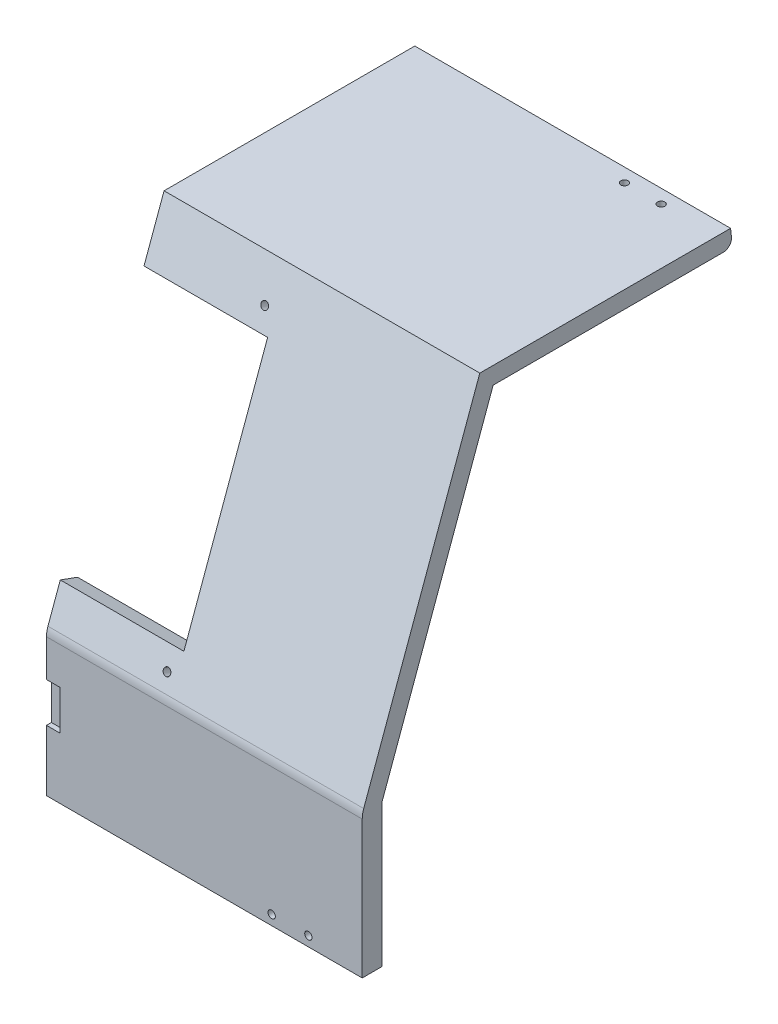
from build123d import *

# Parameters (mm, degrees)
SKETCH1_W                = 170
SKETCH1_H                = 130
BOSS_EXTRUDE1_DEPTH      = 8
SKETCH2_R                = 1.5
SKETCH2_W                = 165
SKETCH2_H                = 100
CUT_EXTRUDE1_DEPTH       = 21
SKETCH3_W                = 170
SKETCH3_H                = 20
BOSS_EXTRUDE2_DEPTH      = 8
SKETCH4_W                = 65
SKETCH4_H                = 16.2
CUT_EXTRUDE2_DEPTH       = 2
SKETCH5_W                = 3.5
SKETCH5_H                = 12
CUT_EXTRUDE3_DEPTH       = 35
SKETCH6_W                = 170
SKETCH6_H                = 150
BOSS_EXTRUDE3_DEPTH      = 8
BOSS_EXTRUDE4_DEPTH      = 138
SKETCH8_W                = 249
SKETCH8_H                = 138
BOSS_EXTRUDE5_DEPTH      = 1
SKETCH9_W                = 72.8
SKETCH9_H                = 73.25
CUT_EXTRUDE4_DEPTH       = 19
BOSS_EXTRUDE6_DEPTH      = 5
SKETCH11_R               = 1.5
CUT_EXTRUDE5_DEPTH       = 56
SKETCH12_R               = 9
SKETCH12_R_2             = 6.5
SKETCH12_R_3             = 1
SKETCH12_R_4             = 2.75
CUT_EXTRUDE6_DEPTH       = 115
SKETCH13_W               = 58.59049163
SKETCH13_H               = 30.075830986
CUT_EXTRUDE7_DEPTH       = 3
FILLET1_R                = 2
SKETCH15_R               = 1.5
CUT_EXTRUDE8_DEPTH       = 10
CUT_EXTRUDE10_DEPTH      = 261
SKETCH19_R               = 1.5
BOSS_EXTRUDE7_DEPTH      = 8
BOSS_EXTRUDE12_START     = -124.5
BOSS_EXTRUDE12_DEPTH     = 249
SKETCH22_R               = 1.5
SKETCH22_W               = 165
SKETCH22_H               = 100
CUT_EXTRUDE11_DEPTH      = 18
FILLET2_R                = 10
SKETCH24_R               = 2
SKETCH24_W               = 3
SKETCH24_H               = 72
CUT_EXTRUDE15_DEPTH      = 42
CUT_EXTRUDE16_DEPTH      = 140
CUT_EXTRUDE16_DEPTH_BACK = 242
SKETCH27_W               = 249
SKETCH27_H               = 105
BOSS_EXTRUDE13_DEPTH     = 7
CUT_EXTRUDE17_DEPTH      = 249
FILLET6_R                = 3
FILLET7_R                = 3
BOSS_EXTRUDE14_DEPTH     = 9
SKETCH30_R               = 1.5
CUT_EXTRUDE18_DEPTH      = 10
SKETCH31_R               = 1.5
CUT_EXTRUDE19_DEPTH      = 49
CUT_EXTRUDE20_DEPTH      = 49
SKETCH34_W               = 129
SKETCH34_H               = 190
CUT_EXTRUDE21_DEPTH      = 222


with BuildPart() as part:
    # Sketch1 → Boss-Extrude1 (new body)
    with BuildSketch(Plane.XY):
        with Locations((85, 65)):
            Rectangle(SKETCH1_W, SKETCH1_H)
    extrude(amount=BOSS_EXTRUDE1_DEPTH)

    # Sketch2 → Cut-Extrude1 (cut)
    with BuildSketch(Plane.XY.offset(8)):
        with Locations((6.55, 123.35)):
            Circle(SKETCH2_R)
        with Locations((163.45, 123.35)):
            Circle(SKETCH2_R)
        with Locations((6.55, 6.65)):
            Circle(SKETCH2_R)
        with Locations((163.45, 6.65)):
            Circle(SKETCH2_R)
        with Locations((85, 65)):
            Rectangle(SKETCH2_W, SKETCH2_H)
    extrude(amount=-CUT_EXTRUDE1_DEPTH, mode=Mode.SUBTRACT)

    # Sketch3 → Boss-Extrude2 (add)
    with BuildSketch(Plane.XY.offset(8)):
        with Locations((85, -10)):
            Rectangle(SKETCH3_W, SKETCH3_H)
    extrude(amount=-BOSS_EXTRUDE2_DEPTH)

    # Sketch4 → Cut-Extrude2 (cut)
    with BuildSketch(Plane.XY.offset(8)):
        with Locations((85, -10)):
            Rectangle(SKETCH4_W, SKETCH4_H)
    extrude(amount=-CUT_EXTRUDE2_DEPTH, mode=Mode.SUBTRACT)

    # Sketch5 → Cut-Extrude3 (cut)
    with BuildSketch(Plane.XY.offset(6)):
        with Locations((63.25, -10)):
            Rectangle(SKETCH5_W, SKETCH5_H)
        with Locations((71.75, -10)):
            Rectangle(SKETCH5_W, SKETCH5_H)
        with Locations((80.75, -10)):
            Rectangle(SKETCH5_W, SKETCH5_H)
        with Locations((89.25, -10)):
            Rectangle(SKETCH5_W, SKETCH5_H)
        with Locations((98.25, -10)):
            Rectangle(SKETCH5_W, SKETCH5_H)
        with Locations((106.75, -10)):
            Rectangle(SKETCH5_W, SKETCH5_H)
    extrude(amount=-CUT_EXTRUDE3_DEPTH, mode=Mode.SUBTRACT)

    # Sketch6 → Boss-Extrude3 (add)
    with BuildSketch(Plane.XY.offset(8)):
        Polygon((15.504384948, 140), (225, 140), (225, -35), (-10, -35), (-10, 140), align=None)
        with Locations((85, 55)):
            Rectangle(SKETCH6_W, SKETCH6_H, mode=Mode.SUBTRACT)
    extrude(amount=-BOSS_EXTRUDE3_DEPTH)

    # Sketch7 → Boss-Extrude4 (add)
    with BuildSketch(Plane.XY.offset(8)):
        Polygon((-10, 140), (-17, 140), (-17, -42), (232, -42), (232, 140), (225, 140), (225, -35), (-10, -35), align=None)
    extrude(amount=-BOSS_EXTRUDE4_DEPTH)

    # Sketch8 → Boss-Extrude5 (add)
    with BuildSketch(Plane.XZ.offset(42)):
        with Locations((107.5, -61)):
            Rectangle(SKETCH8_W, SKETCH8_H)
    extrude(amount=BOSS_EXTRUDE5_DEPTH)

    # Sketch9 → Cut-Extrude4 (cut)
    with BuildSketch(Plane(origin=(232, 0, 0), x_dir=(0, 0, -1), z_dir=(1, 0, 0))):
        with Locations((75, 35)):
            Rectangle(SKETCH9_W, SKETCH9_H)
    extrude(amount=-CUT_EXTRUDE4_DEPTH, mode=Mode.SUBTRACT)

    # Sketch10 → Boss-Extrude6 (add)
    with BuildSketch(Plane(origin=(232, 0, 0), x_dir=(0, 0, -1), z_dir=(1, 0, 0))):
        Polygon((36, 44), (36, -4), (114, -4), (114, 44), (119, 44), (119, -9), (31, -9), (31, 44), align=None)
    extrude(amount=BOSS_EXTRUDE6_DEPTH)

    # Sketch11 → Cut-Extrude5 (cut)
    with BuildSketch(Plane(origin=(237, 0, 0), x_dir=(0, 0, -1), z_dir=(1, 0, 0))):
        with Locations((33.5, 17.5)):
            Circle(SKETCH11_R)
        with Locations((116.5, 17.5)):
            Circle(SKETCH11_R)
    extrude(amount=-CUT_EXTRUDE5_DEPTH, mode=Mode.SUBTRACT)

    # Sketch12 → Cut-Extrude6 (cut)
    with BuildSketch(Plane(origin=(0, -35, 0), x_dir=(1, 0, 0), z_dir=(0, 1, 0))):
        with Locations(Location((166.25, 32.5, 0), (0, 0, 180))):
            Circle(SKETCH12_R)
        with Locations(Location((166.25, 97.5, 0), (0, 0, 180))):
            Circle(SKETCH12_R_2)
        with Locations(Location((155.75, 97.5, 0), (0, 0, 180))):
            Circle(SKETCH12_R_3)
        with Locations(Location((155.75, 85, 0), (0, 0, 180))):
            Circle(SKETCH12_R_3)
        with Locations(Location((176.75, 85, 0), (0, 0, 180))):
            Circle(SKETCH12_R_3)
        with Locations(Location((176.75, 97.5, 0), (0, 0, 180))):
            Circle(SKETCH12_R_3)
        with Locations(Location((145.25, 97.5, 0), (0, 0, 180))):
            Circle(SKETCH12_R_4)
        with Locations(Location((187.25, 97.5, 0), (0, 0, 180))):
            Circle(SKETCH12_R_4)
    extrude(amount=-CUT_EXTRUDE6_DEPTH, mode=Mode.SUBTRACT)

    # Sketch13 → Cut-Extrude7 (cut)
    with BuildSketch(Plane.XZ.offset(43)):
        with Locations((166.25, -93.48757215)):
            Rectangle(SKETCH13_W, SKETCH13_H)
    extrude(amount=-CUT_EXTRUDE7_DEPTH, mode=Mode.SUBTRACT)

    # Fillet1
    fillet1_edges = [part.edges().sort_by_distance(p)[0] for p in [
        (136.954754185, -40, -93.48757215),
        (166.25, -40, -78.449656657),
        (195.545245815, -40, -93.48757215),
        (166.25, -40, -108.525487643),
    ]]
    fillet(fillet1_edges, radius=FILLET1_R)

    # Sketch15 → Cut-Extrude8 (cut)
    with BuildSketch(Plane(origin=(0, 140, 0), x_dir=(1, 0, 0), z_dir=(0, 1, 0))):
        with Locations(Location((5, -4, 0), (0, 0, 270))):
            Circle(SKETCH15_R)
        with Locations(Location((20, -4, 0), (0, 0, 270))):
            Circle(SKETCH15_R)
        with Locations(Location((217, -4, 0), (0, 0, 90))):
            Circle(SKETCH15_R)
        with Locations(Location((202, -4, 0), (0, 0, 90))):
            Circle(SKETCH15_R)
    extrude(amount=-CUT_EXTRUDE8_DEPTH, mode=Mode.SUBTRACT)

    # Sketch18 → Cut-Extrude10 (cut)
    with BuildSketch(Plane(origin=(232, 0, 0), x_dir=(0, 0, -1), z_dir=(1, 0, 0))):
        Polygon((45.496279283, 140), (-8, 140), (-8, 15), (0, 15), align=None)
    extrude(amount=-CUT_EXTRUDE10_DEPTH, mode=Mode.SUBTRACT)

    # Sketch19 → Boss-Extrude7 (add)
    with BuildSketch(Plane.XY.offset(8)):
        with Locations((6.55, 6.65)):
            Circle(SKETCH19_R)
        with Locations((163.45, 6.65)):
            Circle(SKETCH19_R)
    extrude(amount=-BOSS_EXTRUDE7_DEPTH)

    # Sketch21 → Boss-Extrude12 (add)
    with BuildSketch(Plane(origin=(107.5, 0, 0), x_dir=(0, 0, -1), z_dir=(1, 0, 0)).offset(BOSS_EXTRUDE12_START)):
        Polygon((45.496279283, 140), (0, 15), (-8, 15), (37.496279283, 140), align=None)
    extrude(amount=BOSS_EXTRUDE12_DEPTH)

    # Sketch22 → Cut-Extrude11 (cut)
    with BuildSketch(Plane(origin=(0, 4.325817115, 11.885084845), x_dir=(1, 0, 0), z_dir=(0, 0.3420201433256603, 0.9396926207859115))):
        with Locations(Location((1.55, 136.220338945, 0), (0, 0, 270))):
            Circle(SKETCH22_R)
        with Locations(Location((158.45, 136.220338945, 0), (0, 0, 270))):
            Circle(SKETCH22_R)
        with Locations(Location((1.55, 19.520338945, 0), (0, 0, 270))):
            Circle(SKETCH22_R)
        with Locations(Location((158.45, 19.520338945, 0), (0, 0, 270))):
            Circle(SKETCH22_R)
        with Locations((80, 77.870338945)):
            Rectangle(SKETCH22_W, SKETCH22_H)
    extrude(amount=-CUT_EXTRUDE11_DEPTH, mode=Mode.SUBTRACT)

    # Fillet2
    fillet2_edges = [part.edges().sort_by_distance(p)[0] for p in [
        (107.5, 15, 8),
    ]]
    fillet(fillet2_edges, radius=FILLET2_R)

    # Sketch24 → Cut-Extrude15 (cut)
    with BuildSketch(Plane(origin=(-10, 0, 0), x_dir=(0, 0, -1), z_dir=(1, 0, 0))):
        with Locations(Location((113.5, 48.5, 0), (0, 0, 90))):
            Circle(SKETCH24_R)
        with Locations(Location((119.5, 68.5, 0), (0, 0, 90))):
            Circle(SKETCH24_R)
        with Locations(Location((119.5, 28.5, 0), (0, 0, 90))):
            Circle(SKETCH24_R)
        with Locations((128.5, 48.5)):
            Rectangle(SKETCH24_W, SKETCH24_H)
    extrude(amount=-CUT_EXTRUDE15_DEPTH, mode=Mode.SUBTRACT)

    # Sketch25 → Cut-Extrude16 (cut, two sides: drawn at the far end of the back side and taken through both)
    with BuildSketch(Plane(origin=(232, 0, 0), x_dir=(0, 0, -1), z_dir=(1, 0, 0)).offset(-CUT_EXTRUDE16_DEPTH_BACK)):
        Polygon((45.496279283, 140), (130, 140), (130, -43), (0, -43), (0, 15), align=None)
    extrude(amount=CUT_EXTRUDE16_DEPTH + CUT_EXTRUDE16_DEPTH_BACK, mode=Mode.SUBTRACT)

    # Sketch27 → Boss-Extrude13 (add)
    with BuildSketch(Plane(origin=(0, 140, 0), x_dir=(1, 0, 0), z_dir=(0, 1, 0))):
        with Locations((107.5, 89.996279283)):
            Rectangle(SKETCH27_W, SKETCH27_H)
    extrude(amount=BOSS_EXTRUDE13_DEPTH)

    # Sketch28 → Cut-Extrude17 (cut)
    with BuildSketch(Plane(origin=(232, 0, 0), x_dir=(0, 0, -1), z_dir=(1, 0, 0))):
        Polygon((37.496279283, 140), (40.044070923, 147), (37.496279283, 147), align=None)
    extrude(amount=-CUT_EXTRUDE17_DEPTH, mode=Mode.SUBTRACT)

    # Fillet6
    fillet6_edges = [part.edges().sort_by_distance(p)[0] for p in [
        (107.5, 140, -142.496279283),
    ]]
    fillet(fillet6_edges, radius=FILLET6_R)

    # Fillet7
    fillet7_edges = [part.edges().sort_by_distance(p)[0] for p in [
        (-17, 145, -142.496279283),
        (-17, 140, -134.748139642),
        (-17, 140.878679656, -141.617599627),
    ]]
    fillet(fillet7_edges, radius=FILLET7_R)

    # Sketch29 → Boss-Extrude14 (add)
    with BuildSketch(Plane(origin=(232, 0, 0), x_dir=(0, 0, -1), z_dir=(1, 0, 0))):
        with BuildLine():
            Line((-8, -43), (0, -43))
            Line((0, -43), (0, 15))
            Line((0, 15), (45.496279283, 140))
            Line((45.496279283, 140), (139.496279283, 140))
            ThreePointArc((139.496279283, 140), (141.886652657, 140.990125071), (142.876777727, 143.380498444))
            Line((142.876777727, 143.380498444), (142.496279283, 147))
            Line((142.496279283, 147), (40.044070923, 147))
            Line((40.044070923, 147), (-7.396926208, 16.656931626))
            ThreePointArc((-7.396926208, 16.656931626), (-7.84807753, 14.97321197), (-8, 13.236730193))
            Line((-8, 13.236730193), (-8, -43))
        make_face()
    extrude(amount=BOSS_EXTRUDE14_DEPTH)

    # Sketch30 → Cut-Extrude18 (cut)
    with BuildSketch(Plane(origin=(0, 147, 0), x_dir=(1, 0, 0), z_dir=(0, 1, 0))):
        with Locations(Location((218.25, 136.876777727, 0), (0, 0, 270))):
            Circle(SKETCH30_R)
        with Locations(Location((203.25, 136.876777727, 0), (0, 0, 270))):
            Circle(SKETCH30_R)
    extrude(amount=-CUT_EXTRUDE18_DEPTH, mode=Mode.SUBTRACT)

    # Sketch31 → Cut-Extrude19 (cut)
    with BuildSketch(Plane.XY.offset(8)):
        with Locations((219, -39)):
            Circle(SKETCH31_R)
        with Locations((204, -39)):
            Circle(SKETCH31_R)
    extrude(amount=-CUT_EXTRUDE19_DEPTH, mode=Mode.SUBTRACT)

    # Sketch32 → Cut-Extrude20 (cut)
    with BuildSketch(Plane.ZY.offset(17)):
        with BuildLine():
            Line((-110, 0.736730193), (-12, 0.736730193))
            ThreePointArc((-12, 0.736730193), (-4.5, -6.763269807), (-12, -14.263269807))
            Line((-12, -14.263269807), (-110, -14.263269807))
            ThreePointArc((-110, -14.263269807), (-117.5, -6.763269807), (-110, 0.736730193))
        make_face()
        with BuildLine():
            Line((-110, 119.5), (-48.588668173, 119.5))
            ThreePointArc((-48.588668173, 119.5), (-41.088668173, 112), (-48.588668173, 104.5))
            Line((-48.588668173, 104.5), (-110, 104.5))
            ThreePointArc((-110, 104.5), (-117.5, 112), (-110, 119.5))
        make_face()
    extrude(amount=-CUT_EXTRUDE20_DEPTH, mode=Mode.SUBTRACT)

    # Sketch34 → Cut-Extrude21 (cut)
    with BuildSketch(Plane.XY.offset(8)):
        with Locations((47.5, 52)):
            Rectangle(SKETCH34_W, SKETCH34_H)
    extrude(amount=-CUT_EXTRUDE21_DEPTH, mode=Mode.SUBTRACT)


solid = part.part
